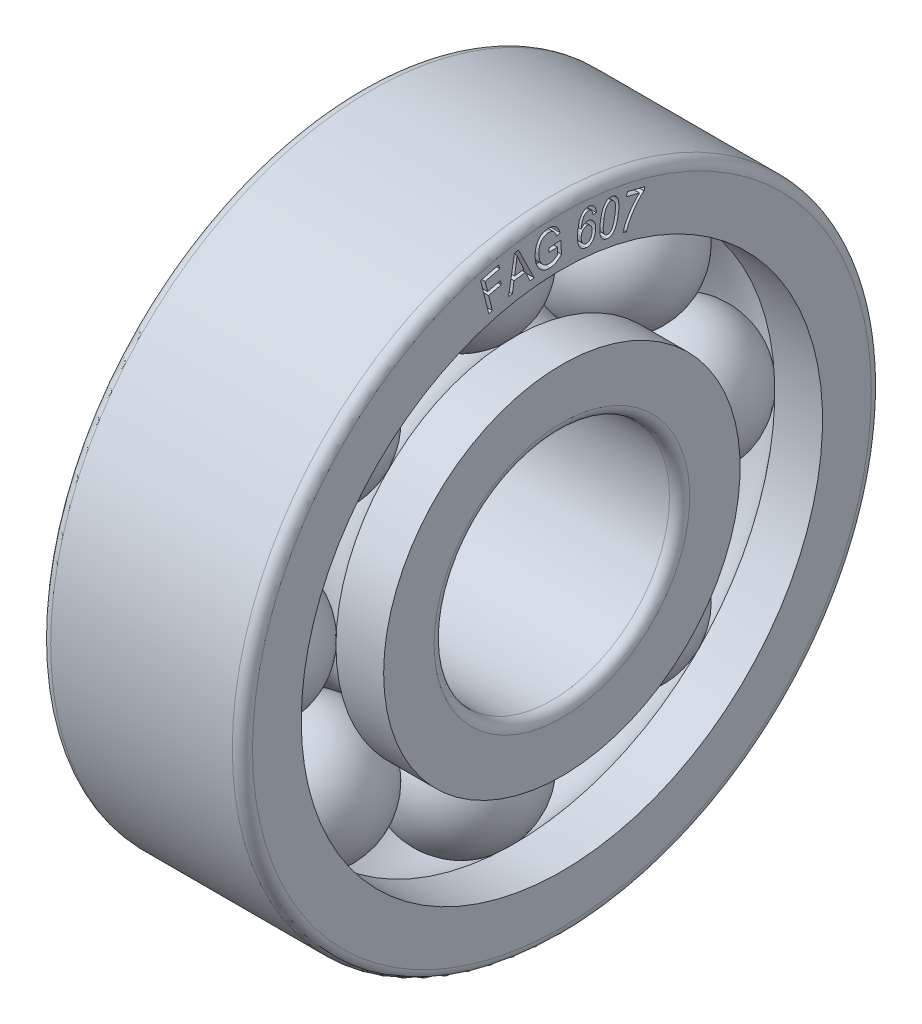
from build123d import *

# Parameters (mm, degrees)
FILLET1_R          = 0.3
FILLET2_R          = 0.3
CIRPATTERN2_COUNT  = 8
CUT_EXTRUDE1_DEPTH = 0.3


with BuildPart() as part:
    # Sketch1 → Revolve1 (revolve)
    with BuildSketch(Plane.XY, mode=Mode.PRIVATE) as revolve1_sk:
        with BuildLine():
            Line((0, 7.75), (1.419058825, 7.75))
            ThreePointArc((1.419058825, 7.75), (3, 8.525), (4.580941175, 7.75))
            Line((4.580941175, 7.75), (6, 7.75))
            Line((6, 7.75), (6, 9.5))
            Line((6, 9.5), (0, 9.5))
            Line((0, 9.5), (0, 7.75))
        make_face()
        with BuildLine():
            Line((0, 3.5), (6, 3.5))
            Line((6, 3.5), (6, 5.3))
            Line((6, 5.3), (4.580941175, 5.3))
            ThreePointArc((4.580941175, 5.3), (3, 4.525), (1.419058825, 5.3))
            Line((1.419058825, 5.3), (0, 5.3))
            Line((0, 5.3), (0, 3.5))
        make_face()
    revolve(revolve1_sk.sketch.rotate(Axis((0, 0, 0), (1, 0, 0)), 90), axis=Axis((0, 0, 0), (1, 0, 0)))

    # Fillet1
    fillet1_edges = [part.edges().sort_by_distance(p)[0] for p in [
        (0, 0, -9.5),
        (6, 0, -9.5),
    ]]
    fillet(fillet1_edges, radius=FILLET1_R)

    # Fillet2
    fillet2_edges = [part.edges().sort_by_distance(p)[0] for p in [
        (6, 0, -3.5),
        (0, 0, -3.5),
    ]]
    fillet(fillet2_edges, radius=FILLET2_R)

    # Sketch4 → Cut-Extrude1 (cut)
    # profile 1 of 6: a face of its own
    with BuildSketch(Plane(origin=(6, 0, 0), x_dir=(0, 0, -1), z_dir=(1, 0, 0))):
        Polygon((-2.173884367, 7.69516203), (-2.417187938, 8.671217224), (-1.877212289, 8.805957484), (-1.848600276, 8.690900666), (-2.282853523, 8.582540276), (-2.20736651, 8.28018638), (-1.831757744, 8.37393638), (-1.803145731, 8.25867664), (-2.178754497, 8.16492664), (-2.068161964, 7.7215419), align=None)
    # profile 2 of 6: a face of its own
    with BuildSketch(Plane(origin=(6, 0, 0), x_dir=(0, 0, -1), z_dir=(1, 0, 0))):
        Polygon((-1.587043547, 7.8410852), (-1.408066274, 8.87821994), (-1.291994846, 8.89384494), (-0.82365069, 7.944372537), (-0.947230235, 7.927530005), (-1.082985106, 8.2160852), (-1.423488352, 8.170021888), (-1.472392573, 7.856507278), align=None)
        with BuildLine():
            Line((-1.40664582, 8.281426109), (-1.130468872, 8.318763771))
            Line((-1.130468872, 8.318763771), (-1.252627963, 8.582968317))
            add(Edge.make_bspline(
                [(-1.252627963, 8.582968317), (-1.257147955, 8.592849304), (-1.265973724, 8.612142988), (-1.279093294, 8.640295187), (-1.290972691, 8.66719304), (-1.301964258, 8.692737903), (-1.312300123, 8.716794729), (-1.321889449, 8.739474291), (-1.330390414, 8.760819931), (-1.335702272, 8.774589947), (-1.33826108, 8.781223187)],
                knots=[0, 0, 0, 0, 1.207294997, 2.357372471, 3.450880303, 4.474239381, 5.447265251, 6.360119919, 7.210043273, 8, 8, 8, 8], degree=3))
            add(Edge.make_bspline(
                [(-1.33826108, 8.781223187), (-1.338883989, 8.764914615), (-1.340131092, 8.732263881), (-1.344191753, 8.683356397), (-1.349240335, 8.634316064), (-1.354224206, 8.601754853), (-1.356726989, 8.585403382)],
                knots=[0, 0, 0, 0, 0.99493625, 1.991921733, 2.991590462, 4, 4, 4, 4], degree=3))
            Line((-1.356726989, 8.585403382), (-1.40664582, 8.281426109))
        make_face(mode=Mode.SUBTRACT)
    # profile 3 of 6: a face of its own
    with BuildSketch(Plane(origin=(6, 0, 0), x_dir=(0, 0, -1), z_dir=(1, 0, 0))):
        with BuildLine():
            Line((-0.376178856, 8.378081437), (-0.382875285, 8.495776242))
            Line((-0.382875285, 8.495776242), (-0.034458077, 8.516880139))
            Line((-0.034458077, 8.516880139), (-0.012948336, 8.144315204))
            add(Edge.make_bspline(
                [(-0.012948336, 8.144315204), (-0.025539534, 8.131132377), (-0.050119912, 8.105397026), (-0.089445401, 8.070900522), (-0.129875163, 8.041385554), (-0.171207884, 8.01664458), (-0.213454835, 7.996726687), (-0.256665071, 7.981909779), (-0.300737974, 7.97160662), (-0.33060603, 7.968915443), (-0.345537622, 7.967570074)],
                knots=[0, 0, 0, 0, 1.131868947, 2.209620481, 3.244052994, 4.236904487, 5.197297732, 6.139274313, 7.069788925, 8, 8, 8, 8], degree=3))
            add(Edge.make_bspline(
                [(-0.345537622, 7.967570074), (-0.355480255, 7.96714806), (-0.3750999, 7.966315307), (-0.404248922, 7.967706109), (-0.432680843, 7.97060358), (-0.460387157, 7.975798668), (-0.487486212, 7.982624801), (-0.513832967, 7.991622004), (-0.539534107, 8.0023343), (-0.564283924, 8.015231984), (-0.588256736, 8.029729492), (-0.61096771, 8.046338241), (-0.632888086, 8.064331685), (-0.65324906, 8.084603184), (-0.672947582, 8.106289503), (-0.691049435, 8.130164245), (-0.708412377, 8.155535369), (-0.72444754, 8.182768307), (-0.738993749, 8.211724386), (-0.752016214, 8.242284529), (-0.76340127, 8.274321933), (-0.772845347, 8.307995713), (-0.781004683, 8.343120512), (-0.787513703, 8.379890799), (-0.792098605, 8.418249783), (-0.794029148, 8.444360472), (-0.795010025, 8.457626892)],
                knots=[0, 0, 0, 0, 0.958083196, 1.890570977, 2.807914002, 3.708822048, 4.603204431, 5.497373219, 6.387950714, 7.282522916, 8.183124656, 9.083655694, 9.990410729, 10.911839729, 11.848415395, 12.810124692, 13.794970561, 14.808428963, 15.851526413, 16.91403715, 18.006177179, 19.123940381, 20.280798938, 21.478330937, 22.718780672, 24, 24, 24, 24], degree=3))
            add(Edge.make_bspline(
                [(-0.795010025, 8.457626892), (-0.795588435, 8.471084284), (-0.796730383, 8.497653007), (-0.796604892, 8.536935277), (-0.794333323, 8.575064046), (-0.79027416, 8.611897948), (-0.784637688, 8.647543828), (-0.777170863, 8.681999241), (-0.76758013, 8.715153741), (-0.756522953, 8.747047339), (-0.743661724, 8.777159552), (-0.729896225, 8.805663121), (-0.715049724, 8.832346372), (-0.698382206, 8.856626656), (-0.681194155, 8.879433991), (-0.662504433, 8.900121504), (-0.642588554, 8.918816111), (-0.621558899, 8.935596748), (-0.599302081, 8.950416555), (-0.575960413, 8.963699975), (-0.551315946, 8.974974582), (-0.525730515, 8.984791056), (-0.499001227, 8.992723599), (-0.47112399, 8.998791548), (-0.442094823, 9.003050544), (-0.422321692, 9.004552341), (-0.412298986, 9.00531358)],
                knots=[0, 0, 0, 0, 1.288788382, 2.544435246, 3.756851362, 4.941904795, 6.088967267, 7.208697424, 8.312887447, 9.3895906, 10.436627236, 11.443983162, 12.417782448, 13.354839462, 14.259715242, 15.148758618, 16.018750214, 16.870862614, 17.719946212, 18.57492971, 19.437886902, 20.310570787, 21.195221232, 22.10293967, 23.038408317, 24, 24, 24, 24], degree=3))
            add(Edge.make_bspline(
                [(-0.412298986, 9.00531358), (-0.397616254, 9.005762852), (-0.369138618, 9.006634229), (-0.32752132, 9.002721902), (-0.288546263, 8.994453551), (-0.252144074, 8.981816485), (-0.218518688, 8.96508399), (-0.187533169, 8.944617463), (-0.159467968, 8.920381395), (-0.138561226, 8.89717892), (-0.123138501, 8.876743881), (-0.112258341, 8.859659197), (-0.101907918, 8.841156876), (-0.092130591, 8.821182644), (-0.083063247, 8.799681324), (-0.074558311, 8.776721826), (-0.066615812, 8.752355965), (-0.061987026, 8.735514975), (-0.059620414, 8.726904489)],
                knots=[0, 0, 0, 0, 1.424245918, 2.762371325, 4.044472707, 5.281536753, 6.490798452, 7.679438468, 8.875376141, 10.078853575, 10.702344892, 11.357732068, 12.042370328, 12.758556972, 13.514336184, 14.305532837, 15.133650363, 16, 16, 16, 16], degree=3))
            Line((-0.059620414, 8.726904489), (-0.155602557, 8.688349294))
            add(Edge.make_bspline(
                [(-0.155602557, 8.688349294), (-0.159652828, 8.701477466), (-0.167307907, 8.726289929), (-0.181282964, 8.760144589), (-0.195981798, 8.78877155), (-0.212104383, 8.8124186), (-0.230022115, 8.831914592), (-0.24982627, 8.848684467), (-0.272011163, 8.862770808), (-0.296188029, 8.874643971), (-0.322263599, 8.883477281), (-0.349790274, 8.889663535), (-0.378760991, 8.892514666), (-0.398429438, 8.891959748), (-0.408443466, 8.891677217)],
                knots=[0, 0, 0, 0, 1.386372001, 2.620266177, 3.692389597, 4.630008934, 5.500015116, 6.357741035, 7.242337583, 8.146331139, 9.070601563, 10.014960388, 10.989333315, 12, 12, 12, 12], degree=3))
            add(Edge.make_bspline(
                [(-0.408443466, 8.891677217), (-0.415825646, 8.891091486), (-0.430304438, 8.889942683), (-0.451544266, 8.886698195), (-0.471861816, 8.881984526), (-0.491339233, 8.876145039), (-0.509956862, 8.869023564), (-0.527682959, 8.860483972), (-0.544509077, 8.850466761), (-0.560641258, 8.839364463), (-0.575707571, 8.826645619), (-0.589959771, 8.812605058), (-0.603351904, 8.79710791), (-0.616041054, 8.780246289), (-0.627518397, 8.761676643), (-0.638281528, 8.741752363), (-0.648252928, 8.720439474), (-0.657136412, 8.69764912), (-0.665077598, 8.673639239), (-0.671529724, 8.648264197), (-0.676843585, 8.621790924), (-0.680540454, 8.593984967), (-0.683570035, 8.565103672), (-0.684582876, 8.534949613), (-0.684665365, 8.503676811), (-0.683694724, 8.482448975), (-0.68319996, 8.471628515)],
                knots=[0, 0, 0, 0, 0.942080174, 1.847717615, 2.730868469, 3.593997165, 4.433148395, 5.264628693, 6.094191337, 6.922681733, 7.753582742, 8.599547696, 9.465888801, 10.357554161, 11.281732922, 12.24064703, 13.237921386, 14.273601438, 15.351411056, 16.453618284, 17.603100446, 18.784992005, 20.021647621, 21.296499246, 22.621945284, 24, 24, 24, 24], degree=3))
            add(Edge.make_bspline(
                [(-0.68319996, 8.471628515), (-0.682078927, 8.455370155), (-0.679908563, 8.423893305), (-0.672953821, 8.37846647), (-0.664351317, 8.33618724), (-0.65269281, 8.297350297), (-0.638959733, 8.261665967), (-0.622559577, 8.229331876), (-0.603619181, 8.200226962), (-0.582200843, 8.174655953), (-0.559091139, 8.152149079), (-0.534115411, 8.133293893), (-0.508047845, 8.117228111), (-0.480444744, 8.104591355), (-0.451434333, 8.095172662), (-0.420986225, 8.089218609), (-0.389163344, 8.085916694), (-0.367526671, 8.08669458), (-0.356495414, 8.087091178)],
                knots=[0, 0, 0, 0, 1.372035112, 2.65631598, 3.867528764, 5.003089876, 6.067389582, 7.083992607, 8.0510349, 8.985440519, 9.88795355, 10.76191017, 11.615862123, 12.462197619, 13.312569365, 14.17846713, 15.071308389, 16, 16, 16, 16], degree=3))
            add(Edge.make_bspline(
                [(-0.356495414, 8.087091178), (-0.345700849, 8.088118618), (-0.323820545, 8.090201212), (-0.291235835, 8.098212764), (-0.258557893, 8.109886613), (-0.226444561, 8.125164539), (-0.196030118, 8.142943776), (-0.168197746, 8.161924185), (-0.143950302, 8.182344929), (-0.130346045, 8.197590236), (-0.123743791, 8.204988905)],
                knots=[0, 0, 0, 0, 0.973018992, 1.972284352, 3.004358147, 4.08617676, 5.161714283, 6.166286297, 7.110084249, 8, 8, 8, 8], degree=3))
            Line((-0.123743791, 8.204988905), (-0.134498661, 8.392083061))
            Line((-0.134498661, 8.392083061), (-0.376178856, 8.378081437))
        make_face()
    # profile 4 of 6: a face of its own
    with BuildSketch(Plane(origin=(6, 0, 0), x_dir=(0, 0, -1), z_dir=(1, 0, 0))):
        with BuildLine():
            Line((1.022801463, 8.701725564), (0.921340424, 8.700508032))
            add(Edge.make_bspline(
                [(0.921340424, 8.700508032), (0.919855723, 8.712717368), (0.917080769, 8.735537001), (0.910188895, 8.766894117), (0.901002381, 8.79307697), (0.892145738, 8.807495029), (0.888061203, 8.814144396)],
                knots=[0, 0, 0, 0, 1.233642525, 2.305716737, 3.218625078, 4, 4, 4, 4], degree=3))
            add(Edge.make_bspline(
                [(0.888061203, 8.814144396), (0.884955309, 8.818261428), (0.878937801, 8.826237965), (0.868874276, 8.836999707), (0.857998588, 8.846076242), (0.846780236, 8.854175787), (0.834539603, 8.86018142), (0.821892367, 8.865163616), (0.808542759, 8.868674876), (0.799335465, 8.869657833), (0.794717047, 8.870150889)],
                knots=[0, 0, 0, 0, 1.098908159, 2.12907741, 3.131530439, 4.115459592, 5.069786867, 6.028352478, 7.011013135, 8, 8, 8, 8], degree=3))
            add(Edge.make_bspline(
                [(0.794717047, 8.870150889), (0.787468087, 8.870401978), (0.77314675, 8.870898038), (0.751933618, 8.867243768), (0.73158227, 8.860261768), (0.712056228, 8.849710205), (0.69344208, 8.835541287), (0.676108454, 8.817526077), (0.659002715, 8.796570421), (0.649110518, 8.780652807), (0.643945943, 8.772342448)],
                knots=[0, 0, 0, 0, 0.913346993, 1.804444907, 2.697951696, 3.618331721, 4.593151031, 5.637367134, 6.766503075, 8, 8, 8, 8], degree=3))
            add(Edge.make_bspline(
                [(0.643945943, 8.772342448), (0.639533065, 8.764367282), (0.630347728, 8.7477671), (0.619092846, 8.720373821), (0.608404387, 8.690374292), (0.599464607, 8.657276212), (0.591279509, 8.621350375), (0.584580846, 8.582375504), (0.578521374, 8.540584096), (0.575898144, 8.511670989), (0.574546593, 8.496774266)],
                knots=[0, 0, 0, 0, 0.763498528, 1.589210232, 2.478713322, 3.432090002, 4.461050194, 5.566694308, 6.74630276, 8, 8, 8, 8], degree=3))
            add(Edge.make_bspline(
                [(0.574546593, 8.496774266), (0.581354526, 8.506688114), (0.594592333, 8.525965275), (0.617774198, 8.551345112), (0.642796139, 8.572675278), (0.669703827, 8.589615576), (0.697791151, 8.602123432), (0.726357062, 8.610961162), (0.755585276, 8.614887229), (0.775027687, 8.614203198), (0.784773865, 8.613860305)],
                knots=[0, 0, 0, 0, 1.139454002, 2.215631677, 3.248893038, 4.249129372, 5.219610901, 6.157226095, 7.076246035, 8, 8, 8, 8], degree=3))
            add(Edge.make_bspline(
                [(0.784773865, 8.613860305), (0.792790687, 8.612907153), (0.808669412, 8.611019268), (0.831746479, 8.604746638), (0.853878939, 8.596036222), (0.874874303, 8.584320703), (0.894861401, 8.569930858), (0.914066182, 8.553092735), (0.93186957, 8.533178117), (0.948651798, 8.510970065), (0.963825055, 8.486597263), (0.976636427, 8.460271592), (0.987046922, 8.432277337), (0.9949067, 8.402570543), (1.000370326, 8.371202489), (1.003344803, 8.338158316), (1.004006267, 8.303427709), (1.002479051, 8.279777291), (1.001697567, 8.26767524)],
                knots=[0, 0, 0, 0, 0.852617716, 1.688759345, 2.520115971, 3.362018381, 4.223320211, 5.120143343, 6.056802359, 7.042315732, 8.060427584, 9.087143916, 10.132619116, 11.21338344, 12.331549988, 13.495087103, 14.718222148, 16, 16, 16, 16], degree=3))
            add(Edge.make_bspline(
                [(1.001697567, 8.26767524), (0.999945147, 8.251320183), (0.996504543, 8.219209559), (0.985537328, 8.172688871), (0.970350258, 8.128868905), (0.954017012, 8.094640855), (0.939167846, 8.069237429), (0.927504195, 8.051630475), (0.915389919, 8.035367353), (0.902591431, 8.020562775), (0.889307915, 8.00707484), (0.87561488, 7.994817999), (0.861029968, 7.984259779), (0.84132008, 7.971950299), (0.815543328, 7.959803306), (0.783328153, 7.949875083), (0.749874611, 7.944962629), (0.72735705, 7.945950573), (0.715983281, 7.94644959)],
                knots=[0, 0, 0, 0, 1.647725348, 3.235053916, 4.779165471, 6.289661346, 7.028185911, 7.72782993, 8.4059464, 9.05982792, 9.68799221, 10.302950759, 10.899731781, 11.490588791, 12.631115379, 13.744404201, 14.860683605, 16, 16, 16, 16], degree=3))
            add(Edge.make_bspline(
                [(0.715983281, 7.94644959), (0.705858258, 7.947609617), (0.685842106, 7.949902873), (0.656976412, 7.95782951), (0.629584734, 7.968745411), (0.604140559, 7.983601489), (0.580246295, 8.00152017), (0.558095927, 8.022973634), (0.537690784, 8.047791597), (0.518782873, 8.076047889), (0.502215243, 8.108274254), (0.489004454, 8.145092099), (0.478172211, 8.186136149), (0.471061503, 8.231774324), (0.466082578, 8.281699479), (0.464536119, 8.336120435), (0.465501419, 8.395035762), (0.468357407, 8.435704071), (0.469838801, 8.456798616)],
                knots=[0, 0, 0, 0, 0.769929789, 1.522073825, 2.256553935, 2.994660954, 3.743753046, 4.510923527, 5.321326047, 6.169965539, 7.078457896, 8.054630296, 9.12319718, 10.28487849, 11.544481314, 12.916541858, 14.400618292, 16, 16, 16, 16], degree=3))
            add(Edge.make_bspline(
                [(0.469838801, 8.456798616), (0.472021419, 8.480154901), (0.476231742, 8.525209729), (0.485284267, 8.589897968), (0.496550854, 8.649190088), (0.510070919, 8.703002963), (0.525523022, 8.751518021), (0.543291192, 8.794574909), (0.563295932, 8.832194288), (0.585609277, 8.864410687), (0.609622641, 8.891779143), (0.634562537, 8.91535816), (0.660862829, 8.934790558), (0.688331894, 8.950212888), (0.716893555, 8.961711743), (0.746661646, 8.969068139), (0.777606393, 8.972424259), (0.79850159, 8.971482131), (0.809124515, 8.971003162)],
                knots=[0, 0, 0, 0, 1.638346639, 3.160409675, 4.560488704, 5.851899004, 7.033733714, 8.11384556, 9.101011577, 10.00401228, 10.844469867, 11.640025251, 12.396931947, 13.122443548, 13.834837596, 14.54070004, 15.258105458, 16, 16, 16, 16], degree=3))
            add(Edge.make_bspline(
                [(0.809124515, 8.971003162), (0.816793423, 8.970219133), (0.831848001, 8.968680032), (0.853686654, 8.963615535), (0.87453953, 8.957004947), (0.894221788, 8.948210421), (0.91287438, 8.937667161), (0.930147392, 8.924898995), (0.946523365, 8.91049761), (0.961434148, 8.894009833), (0.975176687, 8.875904865), (0.987085989, 8.855913779), (0.997513218, 8.834356778), (1.005991851, 8.811007595), (1.012915648, 8.786050713), (1.017867467, 8.759357152), (1.021383416, 8.731096295), (1.022320906, 8.711678899), (1.022801463, 8.701725564)],
                knots=[0, 0, 0, 0, 0.970745785, 1.905638543, 2.819616994, 3.724203021, 4.617753894, 5.51471466, 6.426623122, 7.361982238, 8.311723143, 9.286951041, 10.289810843, 11.325578705, 12.413539221, 13.550533808, 14.744406586, 16, 16, 16, 16], degree=3))
        make_face()
        with BuildLine():
            add(Edge.make_bspline(
                [(0.574343671, 8.302780759), (0.573734383, 8.293923851), (0.572544468, 8.276626653), (0.57307808, 8.251199537), (0.574957882, 8.226897095), (0.578922563, 8.203871182), (0.584047055, 8.181849394), (0.591404936, 8.161232606), (0.600414398, 8.141759947), (0.610896921, 8.123643897), (0.622493013, 8.107054694), (0.635254568, 8.092619554), (0.648325658, 8.079815088), (0.662534068, 8.069490915), (0.677148221, 8.060821594), (0.692501523, 8.054311139), (0.708512724, 8.049668705), (0.719539717, 8.048366221), (0.725114775, 8.047707707)],
                knots=[0, 0, 0, 0, 1.297873205, 2.534695846, 3.716149857, 4.859544872, 5.948933167, 7.019058788, 8.054837355, 9.083171175, 10.076846185, 11.009392794, 11.89808565, 12.74695282, 13.571606756, 14.378321506, 15.180107385, 16, 16, 16, 16], degree=3))
            add(Edge.make_bspline(
                [(0.725114775, 8.047707707), (0.730057981, 8.047486419), (0.73984698, 8.047048202), (0.754499046, 8.049111387), (0.768935365, 8.052648969), (0.783091954, 8.058489847), (0.796973137, 8.066274695), (0.810545531, 8.076128655), (0.824020077, 8.087771297), (0.837120532, 8.101293888), (0.849511057, 8.116608438), (0.86038536, 8.13379509), (0.870238319, 8.152322727), (0.878539609, 8.172520934), (0.885368945, 8.194345184), (0.891068764, 8.217715712), (0.895334838, 8.242671411), (0.896966544, 8.259882957), (0.897801463, 8.26868985)],
                knots=[0, 0, 0, 0, 0.765134874, 1.515191721, 2.282834653, 3.063248862, 3.879637927, 4.743422016, 5.657375308, 6.635700351, 7.657033932, 8.703597296, 9.781848182, 10.904856994, 12.08150298, 13.321949258, 14.629681102, 16, 16, 16, 16], degree=3))
            add(Edge.make_bspline(
                [(0.897801463, 8.26868985), (0.898387303, 8.277343133), (0.899530709, 8.294232047), (0.899325324, 8.318986438), (0.897458555, 8.342361789), (0.894398822, 8.364405217), (0.889223871, 8.384938762), (0.882750272, 8.404093254), (0.874865535, 8.4220138), (0.865084891, 8.438254096), (0.854395293, 8.45309035), (0.842806076, 8.466195441), (0.830293928, 8.477411672), (0.817162317, 8.487106721), (0.80292922, 8.494596356), (0.788066601, 8.500558545), (0.772315924, 8.504707127), (0.761460358, 8.505906634), (0.75595893, 8.506514525)],
                knots=[0, 0, 0, 0, 1.345867198, 2.626775972, 3.837841215, 4.984097971, 6.076488163, 7.119002985, 8.119983728, 9.108498471, 10.055613272, 10.955400203, 11.817717205, 12.659857231, 13.481861396, 14.306543106, 15.141783191, 16, 16, 16, 16], degree=3))
            add(Edge.make_bspline(
                [(0.75595893, 8.506514525), (0.750546005, 8.506783884), (0.739835922, 8.507316841), (0.723835631, 8.505757672), (0.708179123, 8.502643038), (0.692994215, 8.497153288), (0.678132829, 8.490076486), (0.663664247, 8.480976206), (0.64937859, 8.470289248), (0.635922681, 8.457430313), (0.623174599, 8.443249189), (0.611900755, 8.427340086), (0.60198192, 8.410087942), (0.593378464, 8.391372762), (0.586662193, 8.371164765), (0.580788027, 8.34974304), (0.576878517, 8.326754041), (0.575202982, 8.310907682), (0.574343671, 8.302780759)],
                knots=[0, 0, 0, 0, 0.855094164, 1.691900121, 2.532246112, 3.370347277, 4.235397852, 5.127927481, 6.066109929, 7.048812565, 8.063075783, 9.074182105, 10.122543957, 11.20319043, 12.321685596, 13.482853017, 14.709062525, 16, 16, 16, 16], degree=3))
        make_face(mode=Mode.SUBTRACT)
    # profile 5 of 6: a face of its own
    with BuildSketch(Plane(origin=(6, 0, 0), x_dir=(0, 0, -1), z_dir=(1, 0, 0))):
        with BuildLine():
            add(Edge.make_bspline(
                [(1.145462755, 8.417767956), (1.148747775, 8.437954521), (1.155120703, 8.477116404), (1.16708035, 8.533525386), (1.18070297, 8.585844499), (1.195598903, 8.634105362), (1.211892685, 8.678321847), (1.230074245, 8.718256783), (1.249346834, 8.754337962), (1.270485489, 8.786137292), (1.293019338, 8.813786631), (1.317073144, 8.837154439), (1.342546311, 8.856330779), (1.369614768, 8.87083747), (1.397940019, 8.881253176), (1.427741767, 8.886827962), (1.458916618, 8.888394523), (1.479893836, 8.885945463), (1.49063321, 8.884691657)],
                knots=[0, 0, 0, 0, 1.51742437, 2.943799233, 4.276809974, 5.527753781, 6.690291202, 7.770694831, 8.781321444, 9.722337639, 10.599538909, 11.423031328, 12.205006118, 12.957278797, 13.6939696, 14.435177354, 15.198882495, 16, 16, 16, 16], degree=3))
            add(Edge.make_bspline(
                [(1.49063321, 8.884691657), (1.500091314, 8.882891943), (1.518551968, 8.879379198), (1.54492861, 8.870297258), (1.56912333, 8.858091262), (1.591420926, 8.842858298), (1.611512045, 8.824511868), (1.629573683, 8.803097611), (1.645449029, 8.77864647), (1.654046406, 8.760743983), (1.658449768, 8.751574774)],
                knots=[0, 0, 0, 0, 1.029356686, 2.009133843, 2.973847179, 3.921545222, 4.890053242, 5.876227271, 6.912256382, 8, 8, 8, 8], degree=3))
            add(Edge.make_bspline(
                [(1.658449768, 8.751574774), (1.6633307, 8.73935816), (1.673476072, 8.713965034), (1.683625358, 8.672403655), (1.690910721, 8.626734802), (1.694769952, 8.576731948), (1.695562304, 8.522444858), (1.69260139, 8.463878776), (1.687107456, 8.400942481), (1.680793092, 8.357743609), (1.677524444, 8.335381592)],
                knots=[0, 0, 0, 0, 0.747925278, 1.554617356, 2.427984319, 3.378100966, 4.406049166, 5.515851714, 6.714073657, 8, 8, 8, 8], degree=3))
            add(Edge.make_bspline(
                [(1.677524444, 8.335381592), (1.674242224, 8.315261825), (1.667875288, 8.276232978), (1.655866359, 8.219972165), (1.642363155, 8.167822367), (1.627319187, 8.119739908), (1.611037643, 8.075600264), (1.59303236, 8.035575403), (1.573520456, 7.999558644), (1.552509401, 7.967624812), (1.530015493, 7.939803636), (1.505981657, 7.916370111), (1.480402803, 7.89752725), (1.453499625, 7.882789243), (1.425006218, 7.872586256), (1.395138635, 7.8666766), (1.363785736, 7.865131728), (1.342752067, 7.867731359), (1.331948145, 7.869066657)],
                knots=[0, 0, 0, 0, 1.51271861, 2.934410776, 4.267634039, 5.509193866, 6.67191663, 7.7570652, 8.763443169, 9.708790265, 10.590014619, 11.413638328, 12.192751771, 12.940727251, 13.682257098, 14.429474179, 15.193301077, 16, 16, 16, 16], degree=3))
            add(Edge.make_bspline(
                [(1.331948145, 7.869066657), (1.322479737, 7.87091037), (1.303820798, 7.874543688), (1.277240902, 7.884325955), (1.252418879, 7.897088029), (1.229664246, 7.913595236), (1.208901499, 7.933478215), (1.18989024, 7.956635498), (1.17290877, 7.983165494), (1.15763629, 8.013151981), (1.145026279, 8.04734925), (1.135581695, 8.086212578), (1.129537342, 8.129849341), (1.126360512, 8.178198237), (1.126574735, 8.231326355), (1.129755398, 8.289211948), (1.135794344, 8.351990417), (1.142155644, 8.395268534), (1.145462755, 8.417767956)],
                knots=[0, 0, 0, 0, 0.71630384, 1.411585654, 2.097729349, 2.785916265, 3.493889778, 4.229980505, 5.008463342, 5.831737451, 6.727715677, 7.712162582, 8.799752591, 9.99952266, 11.312273779, 12.747721679, 14.309205915, 16, 16, 16, 16], degree=3))
        make_face()
        with BuildLine():
            add(Edge.make_bspline(
                [(1.247938405, 8.401940034), (1.245058577, 8.382542152), (1.239549326, 8.345433054), (1.233326997, 8.291984548), (1.229721606, 8.243303075), (1.227905764, 8.199372327), (1.228386075, 8.160204022), (1.231087403, 8.12573427), (1.235916699, 8.09598382), (1.243226584, 8.070636223), (1.252798643, 8.049239596), (1.262661399, 8.030141406), (1.274404891, 8.013870612), (1.287002015, 7.999735275), (1.30112574, 7.988358817), (1.316367202, 7.979207404), (1.332901078, 7.972622995), (1.344549761, 7.970284506), (1.350414054, 7.969107241)],
                knots=[0, 0, 0, 0, 1.925639978, 3.683843697, 5.282427864, 6.718107868, 8.000190461, 9.126552547, 10.110415128, 10.955296031, 11.707967853, 12.409300721, 13.06175095, 13.672969687, 14.263221465, 14.835060687, 15.413534931, 16, 16, 16, 16], degree=3))
            add(Edge.make_bspline(
                [(1.350414054, 7.969107241), (1.356087998, 7.968430698), (1.367301735, 7.967093607), (1.384286757, 7.968659517), (1.400782107, 7.973047336), (1.417101495, 7.979823136), (1.43300764, 7.989493087), (1.448439521, 8.002094676), (1.463650586, 8.017181905), (1.478842107, 8.035159175), (1.493401409, 8.057274337), (1.507076201, 8.084255796), (1.519955899, 8.116360257), (1.532146567, 8.15348341), (1.543963299, 8.195641347), (1.554740335, 8.243019011), (1.565067351, 8.295468932), (1.571096386, 8.332251302), (1.574237106, 8.351412436)],
                knots=[0, 0, 0, 0, 0.564803585, 1.116253332, 1.676948039, 2.250624977, 2.860823618, 3.513816764, 4.219803359, 4.980789224, 5.841239407, 6.836186537, 7.97223422, 9.26477793, 10.705225598, 12.307852389, 14.07664008, 16, 16, 16, 16], degree=3))
            add(Edge.make_bspline(
                [(1.574237106, 8.351412436), (1.577119639, 8.37080999), (1.582643945, 8.40798494), (1.588835747, 8.461504918), (1.592459734, 8.510318898), (1.594277257, 8.554320296), (1.593757588, 8.593548713), (1.591192449, 8.627986221), (1.585975383, 8.657614685), (1.578749339, 8.682915066), (1.569232933, 8.704282439), (1.55924031, 8.723236434), (1.547581961, 8.739552811), (1.534750564, 8.753618178), (1.520438165, 8.765002588), (1.504988484, 8.774144771), (1.488195646, 8.780763182), (1.476341787, 8.783074944), (1.470341002, 8.784245228)],
                knots=[0, 0, 0, 0, 1.921255532, 3.682040489, 5.276984876, 6.716018483, 7.995181931, 9.118979429, 10.095218412, 10.938175624, 11.689133705, 12.383039933, 13.034004613, 13.648316159, 14.242384264, 14.818627567, 15.401953223, 16, 16, 16, 16], degree=3))
            add(Edge.make_bspline(
                [(1.470341002, 8.784245228), (1.464731637, 8.784839343), (1.453574809, 8.786021014), (1.43677391, 8.784443836), (1.420295033, 8.780407992), (1.404205111, 8.773243195), (1.388481886, 8.763423019), (1.372857847, 8.751142468), (1.357868993, 8.735863679), (1.342786233, 8.717809712), (1.32817749, 8.695769084), (1.314706066, 8.668787022), (1.301752318, 8.636834112), (1.289901051, 8.599618461), (1.277979, 8.557517656), (1.267277722, 8.510188433), (1.256830945, 8.457840886), (1.250987194, 8.421105526), (1.247938405, 8.401940034)],
                knots=[0, 0, 0, 0, 0.558930155, 1.111692169, 1.665554857, 2.237055779, 2.85219988, 3.502563817, 4.205465155, 4.97341929, 5.835917059, 6.824189314, 7.962940412, 9.256451675, 10.70032713, 12.30676764, 14.073174909, 16, 16, 16, 16], degree=3))
        make_face(mode=Mode.SUBTRACT)
    # profile 6 of 6: a face of its own
    with BuildSketch(Plane(origin=(6, 0, 0), x_dir=(0, 0, -1), z_dir=(1, 0, 0))):
        with BuildLine():
            Line((1.918169231, 8.662910413), (1.947592933, 8.778170153))
            Line((1.947592933, 8.778170153), (2.465450076, 8.646270802))
            Line((2.465450076, 8.646270802), (2.441708192, 8.553129569))
            add(Edge.make_bspline(
                [(2.441708192, 8.553129569), (2.4288234, 8.542628206), (2.402537519, 8.521204689), (2.364268664, 8.486190953), (2.326175538, 8.448197854), (2.288024912, 8.407271792), (2.250297055, 8.363056336), (2.212460174, 8.315943789), (2.174990508, 8.265682491), (2.13767114, 8.213064063), (2.101893398, 8.158454244), (2.067944638, 8.103094207), (2.036395906, 8.04722315), (2.00745044, 7.990760448), (1.980575152, 7.933970512), (1.956238161, 7.876691943), (1.934170017, 7.818971029), (1.921332025, 7.779981833), (1.914922478, 7.760515932)],
                knots=[0, 0, 0, 0, 0.827591898, 1.68834552, 2.581493575, 3.506202181, 4.473620243, 5.475189297, 6.514634634, 7.594943403, 8.687033947, 9.76497196, 10.828243756, 11.881238631, 12.923898816, 13.956170305, 14.979589457, 16, 16, 16, 16], degree=3))
            Line((1.914922478, 7.760515932), (1.813664361, 7.786287036))
            add(Edge.make_bspline(
                [(1.813664361, 7.786287036), (1.816542684, 7.796666162), (1.822411176, 7.817827729), (1.833278718, 7.849693344), (1.844800461, 7.882784945), (1.858463669, 7.916666005), (1.872917337, 7.951735731), (1.888995114, 7.987748126), (1.906753637, 8.024574372), (1.931731312, 8.075113174), (1.965553258, 8.137543152), (2.009164915, 8.210344612), (2.05587924, 8.280247485), (2.105287596, 8.346680104), (2.156014263, 8.408907586), (2.206890946, 8.466017315), (2.257510133, 8.517516307), (2.292580262, 8.548320849), (2.30960592, 8.563275672)],
                knots=[0, 0, 0, 0, 0.553790657, 1.129100706, 1.730931769, 2.355573029, 3.007401678, 3.681650311, 4.383363002, 5.109857536, 6.580696127, 8.033339545, 9.47279097, 10.902495986, 12.289499471, 13.600145849, 14.834931695, 16, 16, 16, 16], degree=3))
            Line((2.30960592, 8.563275672), (1.918169231, 8.662910413))
        make_face()
    extrude(amount=-CUT_EXTRUDE1_DEPTH, mode=Mode.SUBTRACT)


with BuildPart() as body_2:
    # Sketch2 → Revolve2 (revolve)
    with BuildSketch(Plane.XY):
        with BuildLine():
            Line((3, 8.525), (3, 4.525))
            ThreePointArc((3, 4.525), (1, 6.525), (3, 8.525))
        make_face()
    revolve(axis=Axis((3, 8.525, 0), (0, -1, 0)))


with BuildPart() as cirpattern2_1:
    # CirPattern2: pattern copy
    add(body_2.part.rotate(Axis((0, 0, 0), (1, 0, 0)), 1 * 360 / CIRPATTERN2_COUNT))


with BuildPart() as cirpattern2_2:
    # CirPattern2: pattern copy
    add(body_2.part.rotate(Axis((0, 0, 0), (1, 0, 0)), 2 * 360 / CIRPATTERN2_COUNT))


with BuildPart() as cirpattern2_3:
    # CirPattern2: pattern copy
    add(body_2.part.rotate(Axis((0, 0, 0), (1, 0, 0)), 3 * 360 / CIRPATTERN2_COUNT))


with BuildPart() as cirpattern2_4:
    # CirPattern2: pattern copy
    add(body_2.part.rotate(Axis((0, 0, 0), (1, 0, 0)), 4 * 360 / CIRPATTERN2_COUNT))


with BuildPart() as cirpattern2_5:
    # CirPattern2: pattern copy
    add(body_2.part.rotate(Axis((0, 0, 0), (1, 0, 0)), 5 * 360 / CIRPATTERN2_COUNT))


with BuildPart() as cirpattern2_6:
    # CirPattern2: pattern copy
    add(body_2.part.rotate(Axis((0, 0, 0), (1, 0, 0)), 6 * 360 / CIRPATTERN2_COUNT))


with BuildPart() as cirpattern2_7:
    # CirPattern2: pattern copy
    add(body_2.part.rotate(Axis((0, 0, 0), (1, 0, 0)), 7 * 360 / CIRPATTERN2_COUNT))


solid = Compound([part.part, body_2.part, cirpattern2_1.part, cirpattern2_2.part, cirpattern2_3.part, cirpattern2_4.part, cirpattern2_5.part, cirpattern2_6.part, cirpattern2_7.part])
